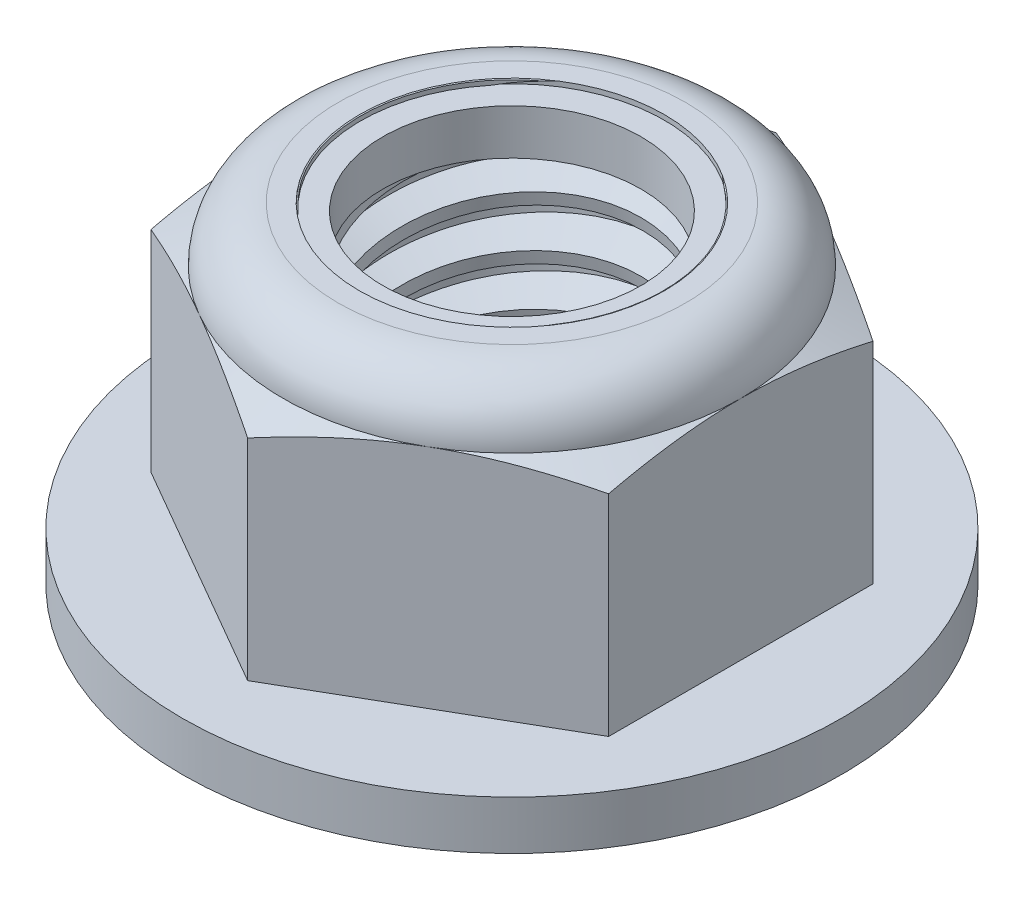
from build123d import *

# Parameters (mm, degrees)
EXTRUDE1_DEPTH      = 10.31875
SKETCH8_W           = 10.287
SKETCH8_H           = 1.524
SKETCH2_W           = 4.7625
SKETCH2_H           = 10.31875
LPATTERN1_COUNT     = 7
LPATTERN1_PITCH     = 1.5875
LPATTERN1_COL_COUNT = 2
LPATTERN1_COL_PITCH = 1.5875


with BuildPart() as part:
    # Sketch1 → Extrude1 (new body)
    with BuildSketch(Plane(origin=(0, 0, 0), x_dir=(1, 0, 0), z_dir=(0, 1, 0))):
        Polygon((0, 8.248891971), (-7.14375, 4.124445986), (-7.14375, -4.124445986), (0, -8.248891971), (7.14375, -4.124445986), (7.14375, 4.124445986), align=None)
    extrude(amount=EXTRUDE1_DEPTH)

    # Sketch8 → Revolve3 (revolve)
    with BuildSketch(Plane(origin=(0, 0, 0), x_dir=(0, 0, -1), z_dir=(1, 0, 0)), mode=Mode.PRIVATE) as revolve3_sk:
        with Locations((5.1435, 0.762)):
            Rectangle(SKETCH8_W, SKETCH8_H)
    revolve(revolve3_sk.sketch.rotate(Axis((0, 0, 0), (0, -1, 0)), 180), axis=Axis((0, 0, 0), (0, -1, 0)))

    # Sketch4 → Cut-Revolve2 (revolve, cut)
    with BuildSketch(Plane(origin=(0, 0, 0), x_dir=(0, 0, -1), z_dir=(1, 0, 0)), mode=Mode.PRIVATE) as cut_revolve2_sk:
        Polygon((0, 10.31875), (4.7625, 10.31875), (4.029111805, 9.976765468), (4.029111805, 0.341984532), (4.7625, 0), (0, 0), align=None)
    revolve(cut_revolve2_sk.sketch.rotate(Axis((0, 10.31875, 0), (0, 1, 0)), 55.157981045), axis=Axis((0, 10.31875, 0), (0, 1, 0)), mode=Mode.SUBTRACT)


with BuildPart() as body_2:
    # Sketch2 → Revolve1 (revolve)
    with BuildSketch(Plane(origin=(0, 0, 0), x_dir=(0, 0, -1), z_dir=(1, 0, 0))):
        with Locations((2.38125, 5.159375)):
            Rectangle(SKETCH2_W, SKETCH2_H)
    revolve(axis=Axis((0, -4.7625, 0), (0, 1, 0)))

    # Sketch3 → Cut-Revolve1 (revolve, cut)
    with BuildSketch(Plane(origin=(0, 0, 0), x_dir=(0, 0, -1), z_dir=(1, 0, 0)), mode=Mode.PRIVATE) as cut_revolve1_sk:
        Polygon((4.795122924, 10.123012456), (5.023483392, 8.752849646), (4.094357653, 9.100932102), (4.029111805, 9.49240719), align=None)
    cut_revolve1 = revolve(cut_revolve1_sk.sketch.rotate(Axis((0, 10.31875, 0.28317269), (0, -0.9863939238321436, -0.1643989873053577)), 180), axis=Axis((0, 10.31875, 0.28317269), (0, -0.9863939238321436, -0.1643989873053577)), mode=Mode.SUBTRACT)

    # LPattern1: Cut-Revolve1 ×7
    with Locations(*[(0, -i * LPATTERN1_PITCH, 0) for i in range(1, LPATTERN1_COUNT)]):
        add(cut_revolve1, mode=Mode.SUBTRACT)

    # LPattern1 col: Cut-Revolve1 ×2
    with Locations(*[(0, i * LPATTERN1_COL_PITCH, 0) for i in range(1, LPATTERN1_COL_COUNT)]):
        add(cut_revolve1, mode=Mode.SUBTRACT)


with BuildPart() as part_1:
    add(part.part)

    # Combine1: cut body 2
    add(body_2.part, mode=Mode.SUBTRACT)

    # Sketch5 → Cut-Revolve3 (revolve, cut)
    with BuildSketch(Plane(origin=(0, 0, 0), x_dir=(0, 0, -1), z_dir=(1, 0, 0)), mode=Mode.PRIVATE) as cut_revolve3_sk:
        with BuildLine():
            Line((8.248891971, 1.524), (8.248891971, 8.083622169))
            Line((8.248891971, 8.083622169), (7.14375, 8.598958333))
            ThreePointArc((7.14375, 8.598958333), (6.640034683, 9.815034683), (5.423958333, 10.31875))
            Line((5.423958333, 10.31875), (5.423958333, 11.58875))
            Line((5.423958333, 11.58875), (9.518891971, 11.58875))
            Line((9.518891971, 11.58875), (9.518891971, 1.524))
            Line((9.518891971, 1.524), (8.248891971, 1.524))
        make_face()
    revolve(cut_revolve3_sk.sketch.rotate(Axis((0, 0, 0), (0, 1, 0)), 55.157981045), axis=Axis((0, 0, 0), (0, 1, 0)), mode=Mode.SUBTRACT)

    # Sketch6 → Cut-Revolve4 (revolve, cut)
    with BuildSketch(Plane(origin=(0, 0, 0), x_dir=(0, 0, -1), z_dir=(1, 0, 0)), mode=Mode.PRIVATE) as cut_revolve4_sk:
        with BuildLine():
            Line((0, 8.598958333), (6.99135, 8.598958333))
            ThreePointArc((6.99135, 8.598958333), (6.53227161, 9.70727161), (5.423958333, 10.16635))
            Line((5.423958333, 10.16635), (4.726535069, 10.16635))
            Line((4.726535069, 10.16635), (4.726535069, 11.58875))
            Line((4.726535069, 11.58875), (0, 11.58875))
            Line((0, 11.58875), (0, 8.598958333))
        make_face()
    revolve(cut_revolve4_sk.sketch.rotate(Axis((0, 11.58875, 0), (0, 1, 0)), 55.157981045), axis=Axis((0, 11.58875, 0), (0, 1, 0)), mode=Mode.SUBTRACT)


with BuildPart() as body_2_2:
    # Sketch7 → Revolve2 (revolve)
    with BuildSketch(Plane(origin=(0, 0, 0), x_dir=(0, 0, -1), z_dir=(1, 0, 0)), mode=Mode.PRIVATE) as revolve2_sk:
        with BuildLine():
            Line((4.029111805, 8.675158333), (6.913201815, 8.675158333))
            ThreePointArc((6.913201815, 8.675158333), (6.451096051, 9.679995195), (5.423958333, 10.09015))
            Line((5.423958333, 10.09015), (4.029111805, 10.09015))
            Line((4.029111805, 10.09015), (4.029111805, 8.675158333))
        make_face()
    revolve(revolve2_sk.sketch.rotate(Axis((0, 8.675158333, 0), (0, 1, 0)), 47.227985619), axis=Axis((0, 8.675158333, 0), (0, 1, 0)))


solid = Compound([part_1.part, body_2_2.part])
